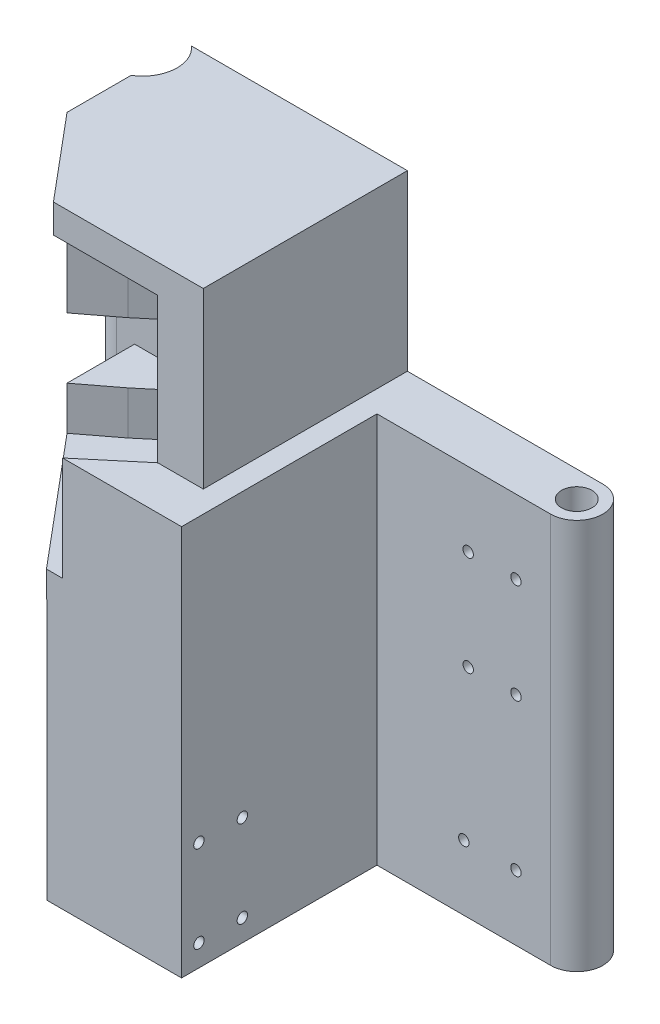
from build123d import *

# Parameters (mm, degrees)
SKETCH1_R            = 4.445
BOSS_EXTRUDE1_DEPTH  = 114.3
BOSS_EXTRUDE3_DEPTH  = 38.1
SKETCH13_W           = 47.954543922
SKETCH13_H           = 15.24
BOSS_EXTRUDE4_DEPTH  = 50.8
BOSS_EXTRUDE5_DEPTH  = 7.62
BOSS_EXTRUDE6_DEPTH  = 8.382
BOSS_EXTRUDE7_DEPTH  = 76.2
BOSS_EXTRUDE8_DEPTH  = 7.62
BOSS_EXTRUDE9_DEPTH  = 8.382
BOSS_EXTRUDE10_DEPTH = 73.66
BOSS_EXTRUDE11_DEPTH = 73.406
SKETCH23_W           = 19.757692601
SKETCH23_H           = 17.78
CUT_EXTRUDE11_DEPTH  = 20.32
SKETCH24_R           = 10.16
CUT_EXTRUDE12_DEPTH  = 50.8
SKETCH25_W           = 23.730892102
SKETCH25_H           = 8.382
CUT_EXTRUDE14_DEPTH  = 12.7
SKETCH26_W           = 33.02
SKETCH26_H           = 76.2
BOSS_EXTRUDE13_DEPTH = 57.15
SKETCH34_R           = 1.524
CUT_EXTRUDE18_DEPTH  = 5.08
SKETCH35_R           = 1.524
CUT_EXTRUDE19_DEPTH  = 5.08
SKETCH36_R           = 1.524
CUT_EXTRUDE20_DEPTH  = 5.08
SKETCH37_W           = 21.59
SKETCH37_H           = 34.29
CUT_EXTRUDE21_DEPTH  = 50.8
SKETCH38_R           = 1.524
CUT_EXTRUDE22_DEPTH  = 10.16
CUT_EXTRUDE23_DEPTH  = 5.08


with BuildPart() as part:
    # Sketch1 → Boss-Extrude1 (new body)
    with BuildSketch(Plane(origin=(0, 0, 0), x_dir=(1, 0, 0), z_dir=(0, 1, 0))):
        with BuildLine():
            Line((0, 7.62), (127, 7.62))
            ThreePointArc((127, 7.62), (134.62, 0), (127, -7.62))
            Line((127, -7.62), (76.2, -7.62))
            Line((76.2, -7.62), (76.2, -64.77))
            Line((76.2, -64.77), (69.85, -64.77))
            Line((69.85, -64.77), (69.85, -7.62))
            Line((69.85, -7.62), (0, -7.62))
            ThreePointArc((0, -7.62), (-7.62, 0), (0, 7.62))
        make_face()
        with Locations(Location((0, 0, 0), (0, 0, 270))):
            Circle(SKETCH1_R, mode=Mode.SUBTRACT)
        with Locations(Location((127, 0, 0), (0, 0, 270))):
            Circle(SKETCH1_R, mode=Mode.SUBTRACT)
    extrude(amount=BOSS_EXTRUDE1_DEPTH)

    # Sketch12 → Boss-Extrude3 (add)
    with BuildSketch(Plane(origin=(0, 114.3, 0), x_dir=(1, 0, 0), z_dir=(0, 1, 0))):
        Polygon((69.85, -7.62), (69.85, -64.77), (21.895456078, -7.62), align=None)
    extrude(amount=-BOSS_EXTRUDE3_DEPTH)

    # Sketch13 → Boss-Extrude4 (add)
    with BuildSketch(Plane(origin=(0, 114.3, 0), x_dir=(1, 0, 0), z_dir=(0, 1, 0))):
        with Locations((45.872728039, 0)):
            Rectangle(SKETCH13_W, SKETCH13_H)
        Polygon((69.85, -7.62), (69.85, -64.77), (21.895456078, -7.62), align=None)
    extrude(amount=BOSS_EXTRUDE4_DEPTH)

    # Sketch14 → Boss-Extrude5 (add)
    with BuildSketch(Plane.XZ.offset(-76.2)):
        Polygon((21.895456078, 7.62), (69.85, 64.77), (53.271327425, 64.77), (12.166691651, 15.783402643), (5.316783504, 7.62), align=None)
    extrude(amount=-BOSS_EXTRUDE5_DEPTH)

    # Sketch15 → Boss-Extrude6 (add)
    with BuildSketch(Plane(origin=(0, 165.1, 0), x_dir=(1, 0, 0), z_dir=(0, 1, 0))):
        Polygon((69.85, -64.77), (53.271327425, -64.77), (5.316783504, -7.62), (5.316783504, 7.62), (21.895456078, 7.62), (21.895456078, -7.62), align=None)
    extrude(amount=-BOSS_EXTRUDE6_DEPTH)

    # Sketch17 → Boss-Extrude7 (add)
    with BuildSketch(Plane.XZ.offset(-156.718)):
        Polygon((12.166691651, 15.783402643), (5.316783504, 7.62), (5.316783504, -7.62), (21.895456078, -7.62), (21.895456078, 7.62), (25.160817135, 11.511505771), (15.432052708, 19.674908414), align=None)
    extrude(amount=BOSS_EXTRUDE7_DEPTH)

    # Sketch18 → Boss-Extrude8 (add)
    with BuildSketch(Plane.XZ.offset(-76.2)):
        Polygon((5.316783504, 7.62), (5.316783504, 27.377692601), (36.692654851, 64.77), (53.271327425, 64.77), align=None)
    extrude(amount=-BOSS_EXTRUDE8_DEPTH)

    # Sketch19 → Boss-Extrude9 (add)
    with BuildSketch(Plane(origin=(0, 165.1, 0), x_dir=(1, 0, 0), z_dir=(0, 1, 0))):
        Polygon((5.316783504, -7.62), (5.316783504, -27.377692601), (36.692654851, -64.77), (53.271327425, -64.77), align=None)
    extrude(amount=-BOSS_EXTRUDE9_DEPTH)

    # Sketch20 → Boss-Extrude10 (add)
    with BuildSketch(Plane.XZ.offset(-156.718)):
        Polygon((15.432052708, 19.674908414), (5.316783504, 27.377692601), (5.316783504, 7.62), align=None)
    extrude(amount=BOSS_EXTRUDE10_DEPTH)

    # Sketch22 → Boss-Extrude11 (add)
    with BuildSketch(Plane.XZ.offset(-156.718)):
        Polygon((69.85, 64.77), (58.094700194, 50.760579224), (41.398922654, 64.77), align=None)
    extrude(amount=BOSS_EXTRUDE11_DEPTH)

    # Sketch23 → Cut-Extrude11 (cut)
    with BuildSketch(Plane.ZY.offset(-5.316783504)):
        with Locations((17.498846301, 105.41)):
            Rectangle(SKETCH23_W, SKETCH23_H)
    extrude(amount=-CUT_EXTRUDE11_DEPTH, mode=Mode.SUBTRACT)

    # Sketch24 → Cut-Extrude12 (cut)
    with BuildSketch(Plane(origin=(0, 165.1, 0), x_dir=(1, 0, 0), z_dir=(0, 1, 0))):
        Circle(SKETCH24_R)
    extrude(amount=-CUT_EXTRUDE12_DEPTH, mode=Mode.SUBTRACT)

    # Sketch25 → Cut-Extrude14 (cut)
    with BuildSketch(Plane.XY.offset(64.77)):
        Polygon((41.398922654, 114.3), (69.85, 114.3), (69.85, 165.1), (36.692654851, 165.1), (36.692654851, 156.718), (41.398922654, 156.718), align=None)
        with Locations((24.8272088, 160.909)):
            Rectangle(SKETCH25_W, SKETCH25_H)
    extrude(amount=-CUT_EXTRUDE14_DEPTH, mode=Mode.SUBTRACT)

    # Sketch26 → Boss-Extrude13 (add)
    with BuildSketch(Plane.XY.offset(7.62)):
        with Locations((53.34, 38.1)):
            Rectangle(SKETCH26_W, SKETCH26_H)
    extrude(amount=BOSS_EXTRUDE13_DEPTH)

    # Sketch34 → Cut-Extrude18 (cut)
    with BuildSketch(Plane(origin=(0, 0, -7.62), x_dir=(-1, 0, 0), z_dir=(0, 0, -1))):
        with Locations((-109.22, 95.25)):
            Circle(SKETCH34_R)
        with Locations((-95.25, 95.25)):
            Circle(SKETCH34_R)
        with Locations((-95.25, 63.5)):
            Circle(SKETCH34_R)
        with Locations((-109.22, 63.5)):
            Circle(SKETCH34_R)
        with Locations((-109.22, 44.45)):
            Circle(SKETCH34_R)
        with Locations((-95.25, 44.45)):
            Circle(SKETCH34_R)
        with Locations((-109.22, 12.7)):
            Circle(SKETCH34_R)
        with Locations((-95.25, 12.7)):
            Circle(SKETCH34_R)
    extrude(amount=-CUT_EXTRUDE18_DEPTH, mode=Mode.SUBTRACT)

    # Sketch35 → Cut-Extrude19 (cut)
    with BuildSketch(Plane.XY.offset(7.62)):
        with Locations((102.87, 92.71)):
            Circle(SKETCH35_R)
        with Locations((116.84, 92.71)):
            Circle(SKETCH35_R)
        with Locations((102.87, 63.5)):
            Circle(SKETCH35_R)
        with Locations((116.84, 63.5)):
            Circle(SKETCH35_R)
        with Locations((101.6, 19.05)):
            Circle(SKETCH35_R)
        with Locations((116.84, 19.05)):
            Circle(SKETCH35_R)
    extrude(amount=-CUT_EXTRUDE19_DEPTH, mode=Mode.SUBTRACT)

    # Sketch36 → Cut-Extrude20 (cut)
    with BuildSketch(Plane(origin=(76.2, 0, 0), x_dir=(0, 0, -1), z_dir=(1, 0, 0))):
        with Locations((-59.69, 6.35)):
            Circle(SKETCH36_R)
        with Locations((-46.99, 6.35)):
            Circle(SKETCH36_R)
        with Locations((-46.99, 31.75)):
            Circle(SKETCH36_R)
        with Locations((-59.69, 31.75)):
            Circle(SKETCH36_R)
    extrude(amount=-CUT_EXTRUDE20_DEPTH, mode=Mode.SUBTRACT)

    # Sketch37 → Cut-Extrude21 (cut)
    with BuildSketch(Plane.XZ):
        with Locations((57.785, 24.765)):
            Rectangle(SKETCH37_W, SKETCH37_H)
    extrude(amount=-CUT_EXTRUDE21_DEPTH, mode=Mode.SUBTRACT)

    # Sketch38 → Cut-Extrude22 (cut)
    with BuildSketch(Plane.XZ):
        with Locations(Location((57.785, 48.26, 0), (0, 0, 270))):
            Circle(SKETCH38_R)
        with Locations(Location((57.785, 2.54, 0), (0, 0, 270))):
            Circle(SKETCH38_R)
    extrude(amount=-CUT_EXTRUDE22_DEPTH, mode=Mode.SUBTRACT)

    # Sketch39 → Cut-Extrude23 (cut)
    with BuildSketch(Plane(origin=(0, 0, -7.62), x_dir=(-1, 0, 0), z_dir=(0, 0, -1))):
        with BuildLine():
            ThreePointArc((-55.88, 102.87), (-57.15, 104.14), (-58.42, 102.87))
            Line((-58.42, 102.87), (-55.88, 102.87))
        make_face()
        with BuildLine():
            Line((-55.88, 102.87), (-58.42, 102.87))
            ThreePointArc((-58.42, 102.87), (-57.15, 101.6), (-55.88, 102.87))
        make_face()
        with BuildLine():
            ThreePointArc((-58.42, 39.37), (-57.15, 38.1), (-55.88, 39.37))
            Line((-55.88, 39.37), (-58.42, 39.37))
        make_face()
        with BuildLine():
            Line((-58.42, 39.37), (-55.88, 39.37))
            ThreePointArc((-55.88, 39.37), (-57.15, 40.64), (-58.42, 39.37))
        make_face()
        with BuildLine():
            ThreePointArc((-74.93, 71.12), (-75.301974388, 72.018025612), (-76.2, 72.39))
            Line((-76.2, 72.39), (-76.2, 69.85))
            ThreePointArc((-76.2, 69.85), (-75.301974388, 70.221974388), (-74.93, 71.12))
        make_face()
        with BuildLine():
            Line((-76.2, 69.85), (-76.2, 72.39))
            ThreePointArc((-76.2, 72.39), (-77.47, 71.12), (-76.2, 69.85))
        make_face()
    extrude(amount=-CUT_EXTRUDE23_DEPTH, mode=Mode.SUBTRACT)


solid = part.part
